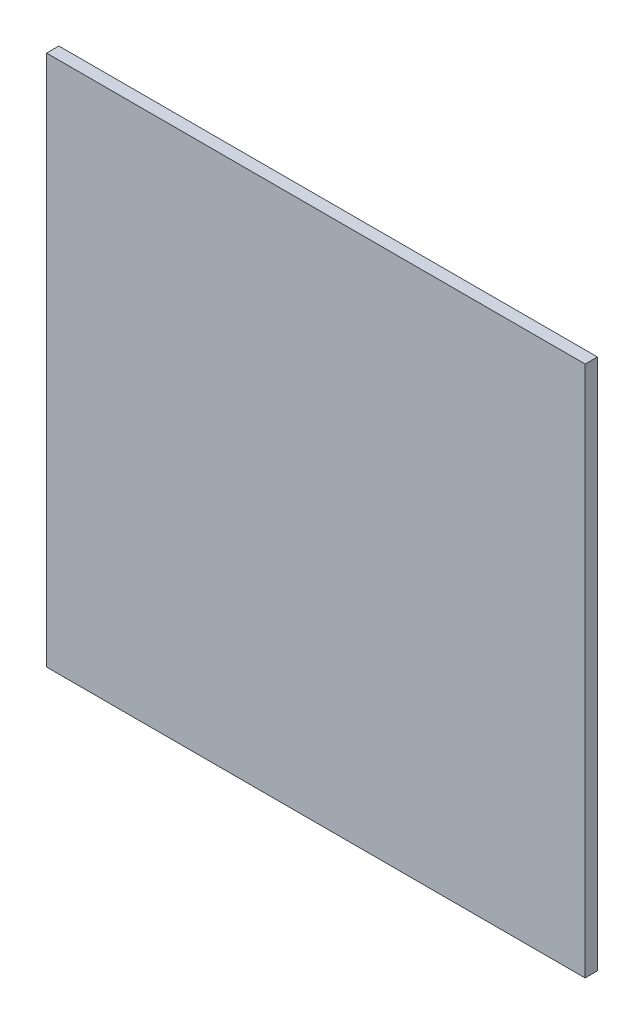
from build123d import *

# Parameters (mm, degrees)
SKETCH1_W           = 395
SKETCH1_H           = 390
BOSS_EXTRUDE1_DEPTH = 9


with BuildPart() as part:
    # Sketch1 → Boss-Extrude1 (new body)
    with BuildSketch(Plane.XY):
        with Locations((168.893867925, -179.91509434)):
            Rectangle(SKETCH1_W, SKETCH1_H)
    extrude(amount=BOSS_EXTRUDE1_DEPTH)


solid = part.part
